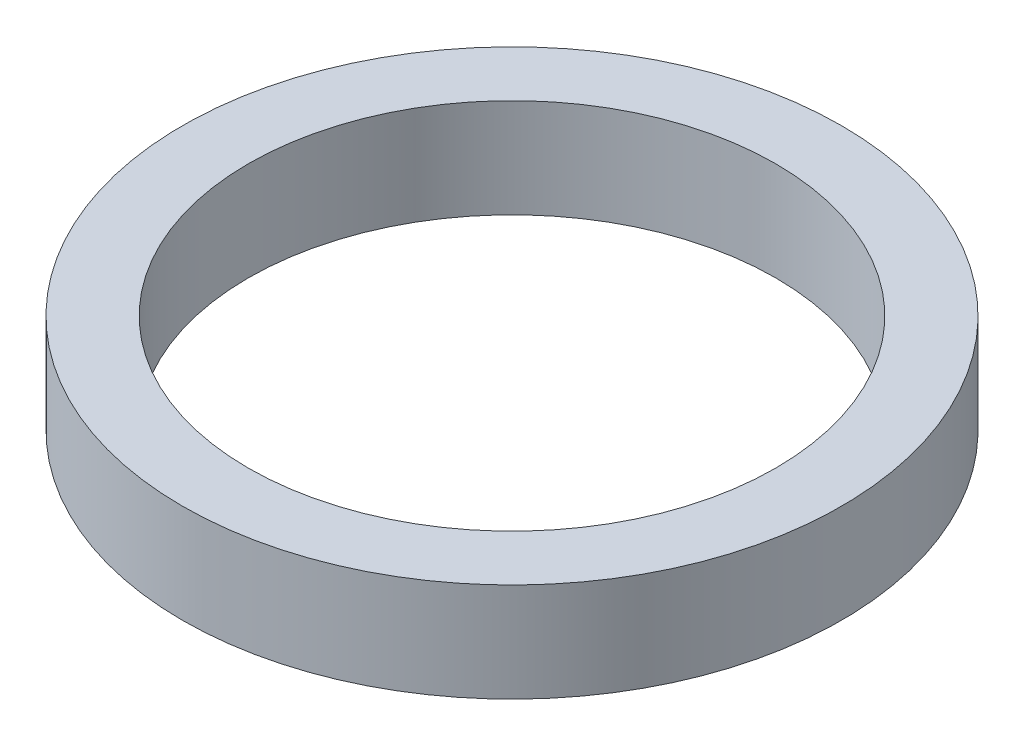
from build123d import *

# Parameters (mm, degrees)
SKETCH1_R           = 5
SKETCH1_R_2         = 4
BOSS_EXTRUDE1_DEPTH = 1.5


with BuildPart() as part:
    # Sketch1 → Boss-Extrude1 (new body)
    with BuildSketch(Plane(origin=(0, 0, 0), x_dir=(1, 0, 0), z_dir=(0, 1, 0))):
        with Locations(Location((0, 0, 0), (0, 0, 270))):
            Circle(SKETCH1_R)
        with Locations(Location((0, 0, 0), (0, 0, 270))):
            Circle(SKETCH1_R_2, mode=Mode.SUBTRACT)
    extrude(amount=BOSS_EXTRUDE1_DEPTH)


solid = part.part
